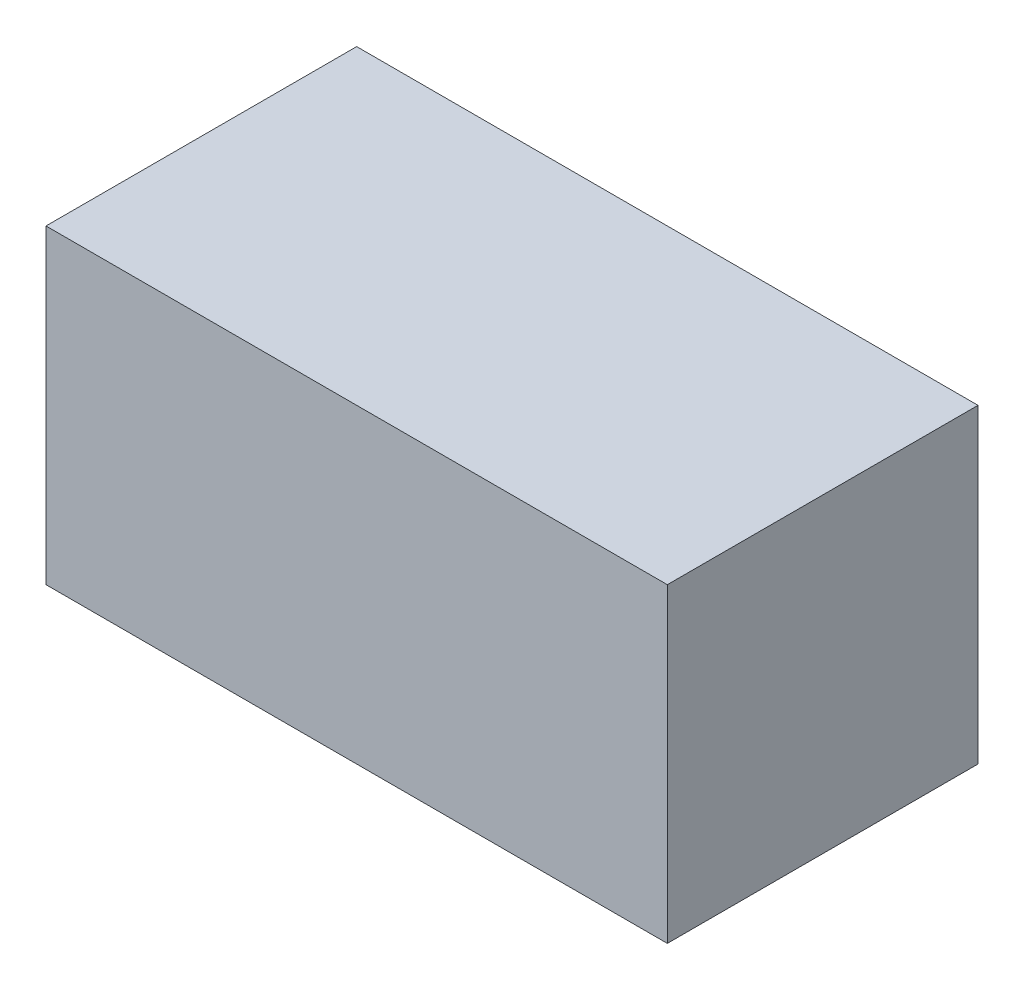
from build123d import *

# Parameters (mm, degrees)
SKETCH1_W           = 1000
SKETCH1_H           = 500
BOSS_EXTRUDE1_DEPTH = 500


with BuildPart() as part:
    # Sketch1 → Boss-Extrude1 (new body)
    with BuildSketch(Plane(origin=(0, 0, 0), x_dir=(1, 0, 0), z_dir=(0, 1, 0))):
        with Locations((12.720156556, -2.446183953)):
            Rectangle(SKETCH1_W, SKETCH1_H)
    extrude(amount=BOSS_EXTRUDE1_DEPTH)


solid = part.part
